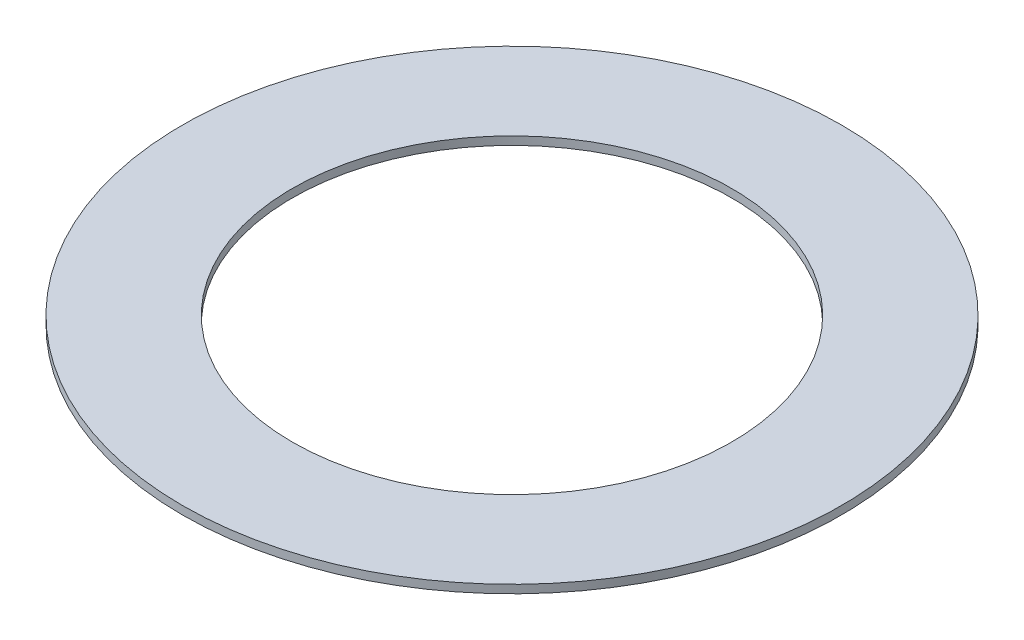
from build123d import *

# Parameters (mm, degrees)
SKETCH1_R           = 120
SKETCH1_R_2         = 80
BOSS_EXTRUDE1_DEPTH = 1.5


with BuildPart() as part:
    # Sketch1 → Boss-Extrude1 (new, symmetric)
    with BuildSketch(Plane(origin=(0, 0, 0), x_dir=(1, 0, 0), z_dir=(0, 1, 0))):
        with Locations(Location((0, 0, 0), (0, 0, 270))):
            Circle(SKETCH1_R)
        with Locations(Location((0, 0, 0), (0, 0, 270))):
            Circle(SKETCH1_R_2, mode=Mode.SUBTRACT)
    extrude(amount=BOSS_EXTRUDE1_DEPTH, both=True)


solid = part.part
